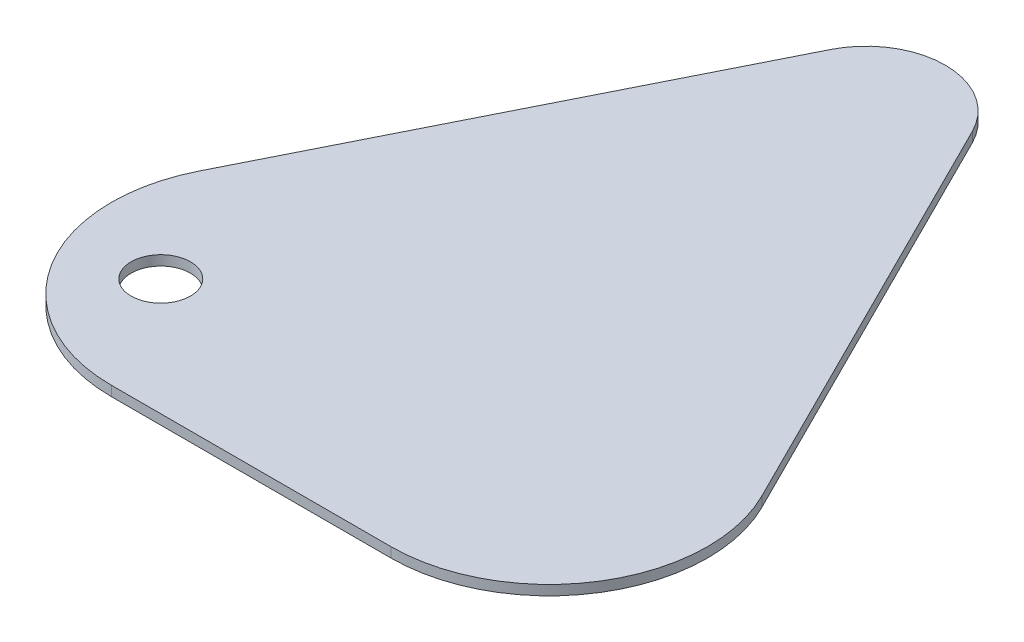
from build123d import *

# Parameters (mm, degrees)
SKETCH1_R           = 1.5
BOSS_EXTRUDE1_DEPTH = 0.25


with BuildPart() as part:
    # Sketch1 → Boss-Extrude1 (new, symmetric)
    with BuildSketch(Plane(origin=(0, 0, 0), x_dir=(1, 0, 0), z_dir=(0, 1, 0))):
        with BuildLine():
            Line((0, 0), (7.05572809, 0))
            ThreePointArc((7.05572809, 0), (13.860934557, 3.794151103), (14.211145618, 11.577708764))
            Line((14.211145618, 11.577708764), (3.577708764, 32.844582472))
            ThreePointArc((3.577708764, 32.844582472), (0, 35.05572809), (-3.577708764, 32.844582472))
            Line((-3.577708764, 32.844582472), (-14.211145618, 11.577708764))
            ThreePointArc((-14.211145618, 11.577708764), (-13.860934557, 3.794151103), (-7.05572809, 0))
            Line((-7.05572809, 0), (0, 0))
        make_face()
        with Locations(Location((-10.458331323, 5.897075552, 0), (0, 0, 270))):
            Circle(SKETCH1_R, mode=Mode.SUBTRACT)
    extrude(amount=BOSS_EXTRUDE1_DEPTH, both=True)


solid = part.part
